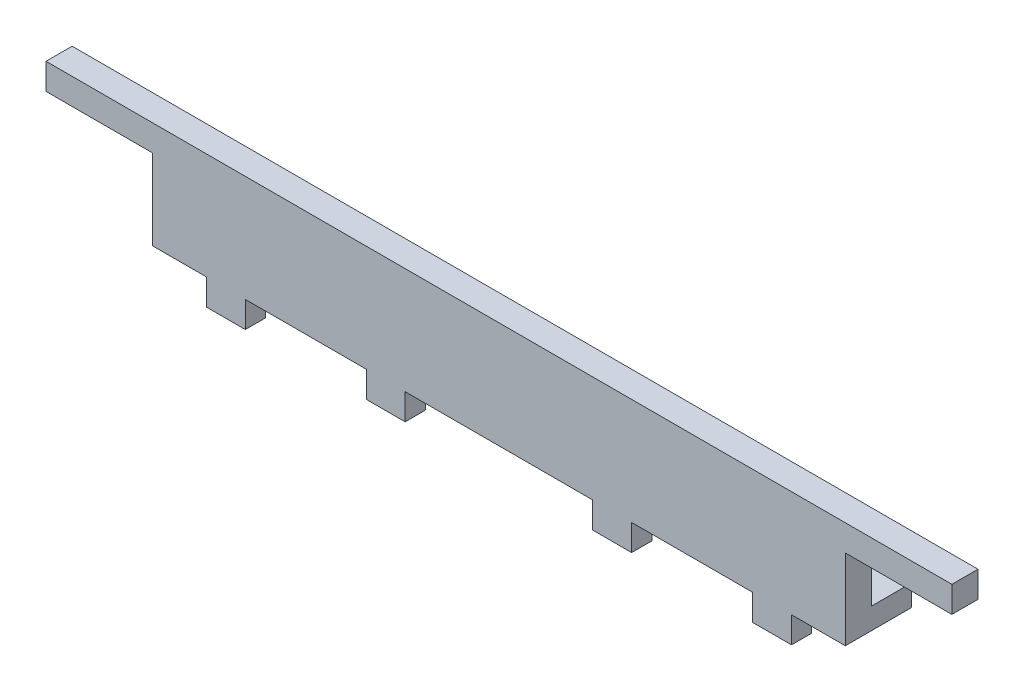
from build123d import *

# Parameters (mm, degrees)
SKETCH1_W           = 130
SKETCH1_H           = 20
BOSS_EXTRUDE1_DEPTH = 4.9
SKETCH3_W           = 4.9
SKETCH3_H           = 4.9
BOSS_EXTRUDE2_DEPTH = 20
SKETCH4_W           = 130
SKETCH4_H           = 4
BOSS_EXTRUDE3_DEPTH = 7.5
SKETCH5_W           = 7.3
SKETCH5_H           = 3.8
BOSS_EXTRUDE4_DEPTH = 4.9
SKETCH6_W           = 7.3
SKETCH6_H           = 3.8
BOSS_EXTRUDE5_DEPTH = 4.9


with BuildPart() as part:
    # Sketch1 → Boss-Extrude1 (new body)
    with BuildSketch(Plane.XY):
        with Locations((7.416107383, 21.263982103)):
            Rectangle(SKETCH1_W, SKETCH1_H)
    extrude(amount=BOSS_EXTRUDE1_DEPTH)

    # Sketch3 → Boss-Extrude2 (add)
    with BuildSketch(Plane(origin=(72.416107383, 0, 0), x_dir=(0, 0, -1), z_dir=(1, 0, 0))):
        with Locations((-2.45, 28.813982103)):
            Rectangle(SKETCH3_W, SKETCH3_H)
    boss_extrude2 = extrude(amount=BOSS_EXTRUDE2_DEPTH)

    # Mirror1: Boss-Extrude2 across plane
    add(boss_extrude2.mirror(Plane.ZY.offset(-7.416107383)))

    # Sketch4 → Boss-Extrude3 (add)
    with BuildSketch(Plane(origin=(0, 0, 0), x_dir=(-1, 0, 0), z_dir=(0, 0, -1))):
        with Locations((-7.416107383, 13.263982103)):
            Rectangle(SKETCH4_W, SKETCH4_H)
    extrude(amount=BOSS_EXTRUDE3_DEPTH)

    # Sketch5 → Boss-Extrude4 (add)
    with BuildSketch(Plane.XZ.offset(-11.263982103)):
        with Locations((28.666107383, 3)):
            Rectangle(SKETCH5_W, SKETCH5_H)
    boss_extrude4 = extrude(amount=BOSS_EXTRUDE4_DEPTH)

    # Mirror2: Boss-Extrude4 across plane
    add(boss_extrude4.mirror(Plane.ZY.offset(-7.416107383)))

    # Sketch6 → Boss-Extrude5 (add)
    with BuildSketch(Plane.XZ.offset(-11.263982103)):
        with Locations((58.666107383, 3)):
            Rectangle(SKETCH6_W, SKETCH6_H)
    boss_extrude5 = extrude(amount=BOSS_EXTRUDE5_DEPTH)

    # Mirror3: Boss-Extrude5 across plane
    add(boss_extrude5.mirror(Plane.ZY.offset(-7.416107383)))


solid = part.part
